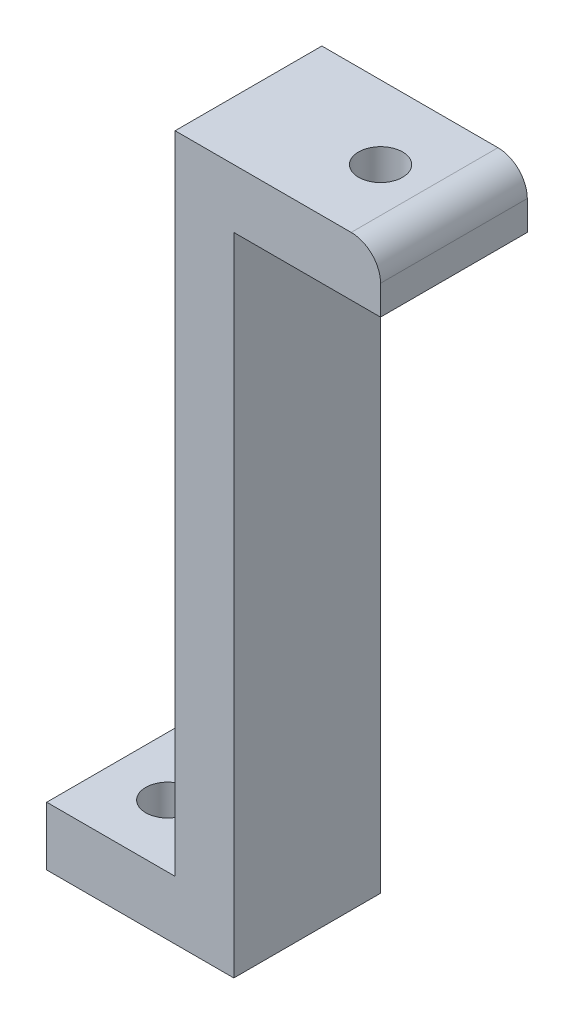
from build123d import *

# Parameters (mm, degrees)
BOSS_EXTRUDE1_DEPTH = 10
SKETCH2_R           = 1.5
CUT_EXTRUDE1_DEPTH  = 10
SKETCH3_R           = 1.5
CUT_EXTRUDE2_DEPTH  = 10
FILLET1_R           = 2


with BuildPart() as part:
    # Sketch1 → Boss-Extrude1 (new body)
    with BuildSketch(Plane.XY):
        Polygon((0, 0), (-14, 0), (-14, -44), (-22.75, -44), (-22.75, -48), (-10, -48), (-10, -4), (0, -4), align=None)
    extrude(amount=BOSS_EXTRUDE1_DEPTH)

    # Sketch2 → Cut-Extrude1 (cut)
    with BuildSketch(Plane(origin=(0, -44, 0), x_dir=(1, 0, 0), z_dir=(0, 1, 0))):
        with Locations(Location((-18.75, -5.75, 0), (0, 0, 270))):
            Circle(SKETCH2_R)
    extrude(amount=-CUT_EXTRUDE1_DEPTH, mode=Mode.SUBTRACT)

    # Sketch3 → Cut-Extrude2 (cut)
    with BuildSketch(Plane(origin=(0, -4, 0), x_dir=(-1, 0, 0), z_dir=(0, -1, 0))):
        with Locations(Location((5, -5, 0), (0, 0, 90))):
            Circle(SKETCH3_R)
    extrude(amount=-CUT_EXTRUDE2_DEPTH, mode=Mode.SUBTRACT)

    # Fillet1
    fillet1_edges = [part.edges().sort_by_distance(p)[0] for p in [
        (0, 0, 5),
    ]]
    fillet(fillet1_edges, radius=FILLET1_R)


solid = part.part
